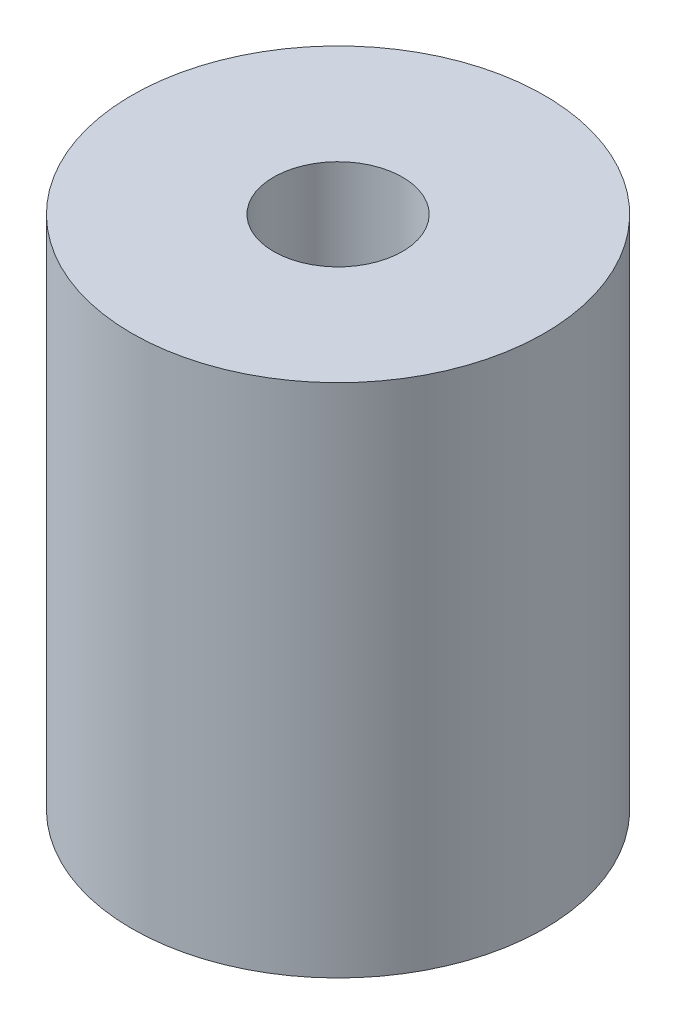
from build123d import *

# Parameters (mm, degrees)
SKETCH_1_R      = 4
SKETCH_1_R_2    = 1.25
EXTRUDE_1_DEPTH = 10


with BuildPart() as part:
    # Эскиз1 → Бобышка-Вытянуть1 (new body)
    with BuildSketch(Plane(origin=(0, 0, 0), x_dir=(1, 0, 0), z_dir=(0, 1, 0))):
        with Locations(Location((0, 0, 0), (0, 0, 270))):
            Circle(SKETCH_1_R)
        with Locations(Location((0, 0, 0), (0, 0, 270))):
            Circle(SKETCH_1_R_2, mode=Mode.SUBTRACT)
    extrude(amount=EXTRUDE_1_DEPTH)


solid = part.part
